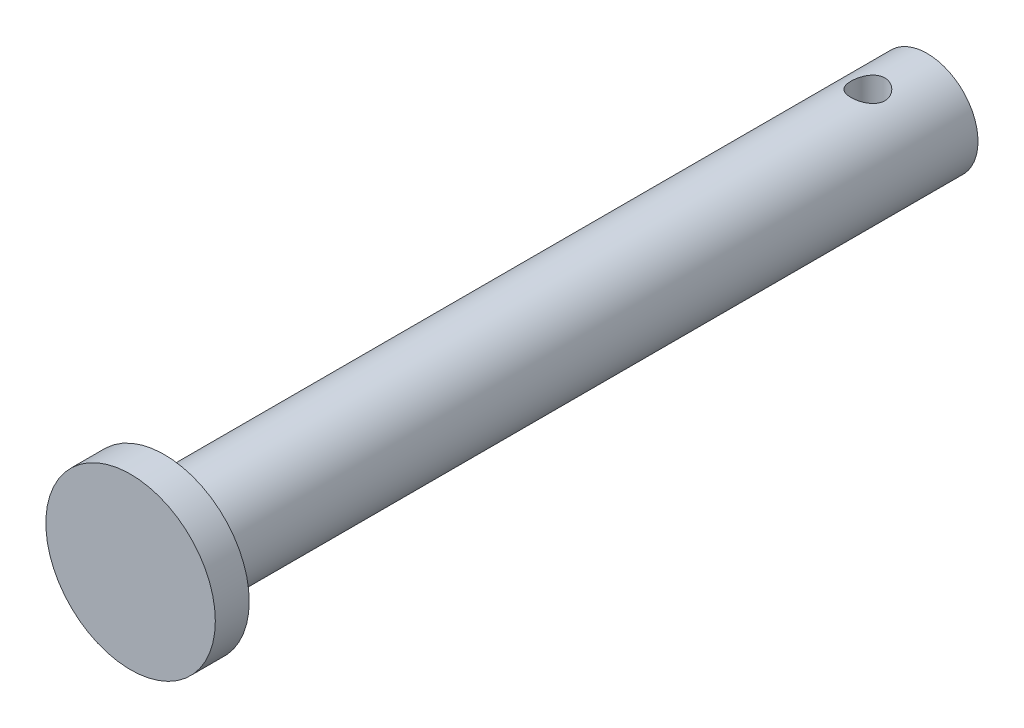
from build123d import *

# Parameters (mm, degrees)
SKETCH1_R               = 3
BOSS_EXTRUDE1_DEPTH     = 45
SKETCH2_R               = 5
BOSS_EXTRUDE2_DEPTH     = 2
CUT_EXTRUDE1_DEPTH      = 48.528938553
CUT_EXTRUDE1_DEPTH_BACK = 48.528938553
SKETCH3_R               = 1
SKETCH4_R               = 1.5
CUT_EXTRUDE2_DEPTH      = 45


with BuildPart() as part:
    # Sketch1 → Boss-Extrude1 (new body)
    with BuildSketch(Plane.XY):
        with Locations(Location((0, 0, 0), (0, 0, 180))):
            Circle(SKETCH1_R)
    extrude(amount=BOSS_EXTRUDE1_DEPTH)

    # Sketch2 → Boss-Extrude2 (add)
    with BuildSketch(Plane.XY.offset(45)):
        Circle(SKETCH2_R)
    extrude(amount=BOSS_EXTRUDE2_DEPTH)

    # Sketch3 → Cut-Extrude1 (cut, two sides: drawn at the far end of the back side and taken through both)
    with BuildSketch(Plane(origin=(0, 0, 0), x_dir=(1, 0, 0), z_dir=(0, 1, 0)).offset(-CUT_EXTRUDE1_DEPTH_BACK)):
        with Locations(Location((0, -3.5, 0), (0, 0, 270))):
            Circle(SKETCH3_R)
    extrude(amount=CUT_EXTRUDE1_DEPTH + CUT_EXTRUDE1_DEPTH_BACK, mode=Mode.SUBTRACT)

    # Sketch4 → Cut-Extrude2 (cut)
    with BuildSketch(Plane(origin=(0, 0, 0), x_dir=(-1, 0, 0), z_dir=(0, 0, -1))):
        Circle(SKETCH4_R)
    extrude(amount=-CUT_EXTRUDE2_DEPTH, mode=Mode.SUBTRACT)


solid = part.part
